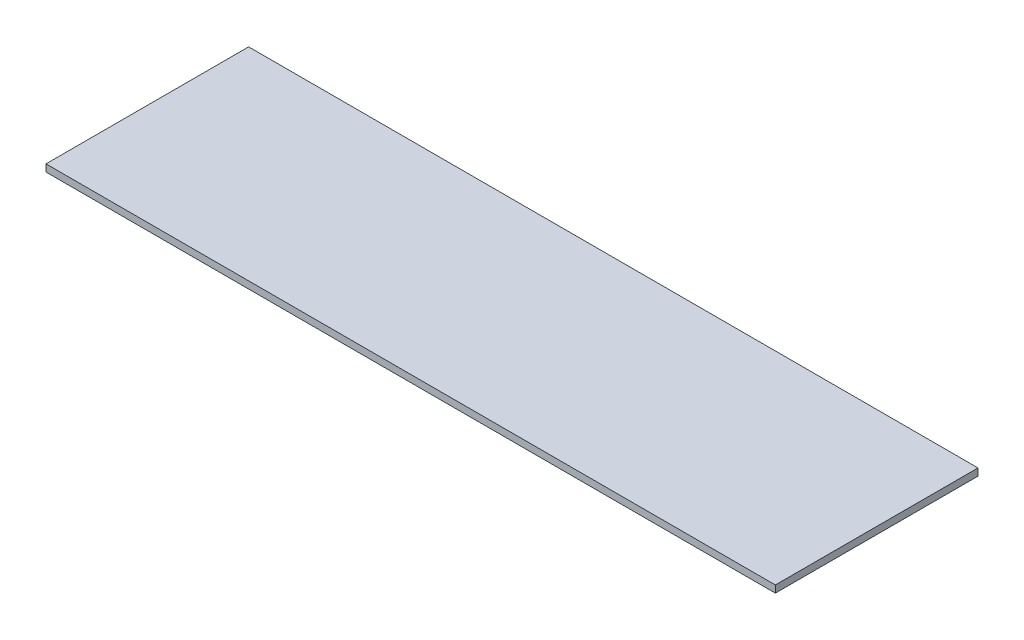
from build123d import *

# Parameters (mm, degrees)
SKETCH1_W           = 512.8
SKETCH1_H           = 142.48
BOSS_EXTRUDE1_DEPTH = 5


with BuildPart() as part:
    # Sketch1 → Boss-Extrude1 (new body)
    with BuildSketch(Plane(origin=(0, 0, 0), x_dir=(1, 0, 0), z_dir=(0, 1, 0))):
        with Locations((-169.328806941, -21.429002169)):
            Rectangle(SKETCH1_W, SKETCH1_H)
    extrude(amount=BOSS_EXTRUDE1_DEPTH)


solid = part.part
